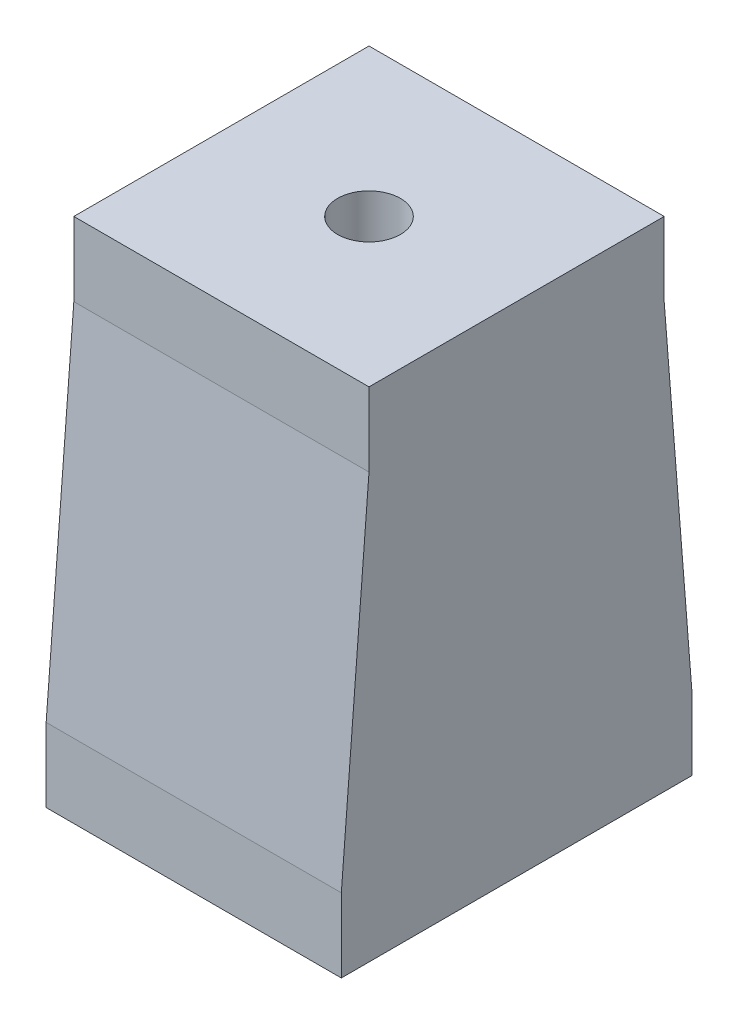
from build123d import *

# Parameters (mm, degrees)
BOSS_EXTRUDE3_DEPTH      = 4
BOSS_EXTRUDE3_DEPTH_BACK = 4
SKETCH11_R               = 0.85
CUT_EXTRUDE5_DEPTH       = 15.859761102


with BuildPart() as part:
    # Sketch6 → Boss-Extrude3 (new, two sides: drawn at the far end of the back side and taken through both)
    with BuildSketch(Plane.ZY.offset(-BOSS_EXTRUDE3_DEPTH_BACK)):
        Polygon((-4.75, 2), (-4.75, 0), (4.75, 0), (4.75, 2), (4, 11.5), (4, 13.5), (-4, 13.5), (-4, 11.5), align=None)
    extrude(amount=BOSS_EXTRUDE3_DEPTH + BOSS_EXTRUDE3_DEPTH_BACK)

    # Sketch11 → Cut-Extrude5 (cut, through all)
    with BuildSketch(Plane(origin=(0, 13.5, 0), x_dir=(1, 0, 0), z_dir=(0, 1, 0))):
        with Locations(Location((0, 0, 0), (0, 0, 270))):
            Circle(SKETCH11_R)
    extrude(amount=-CUT_EXTRUDE5_DEPTH, mode=Mode.SUBTRACT)


solid = part.part
